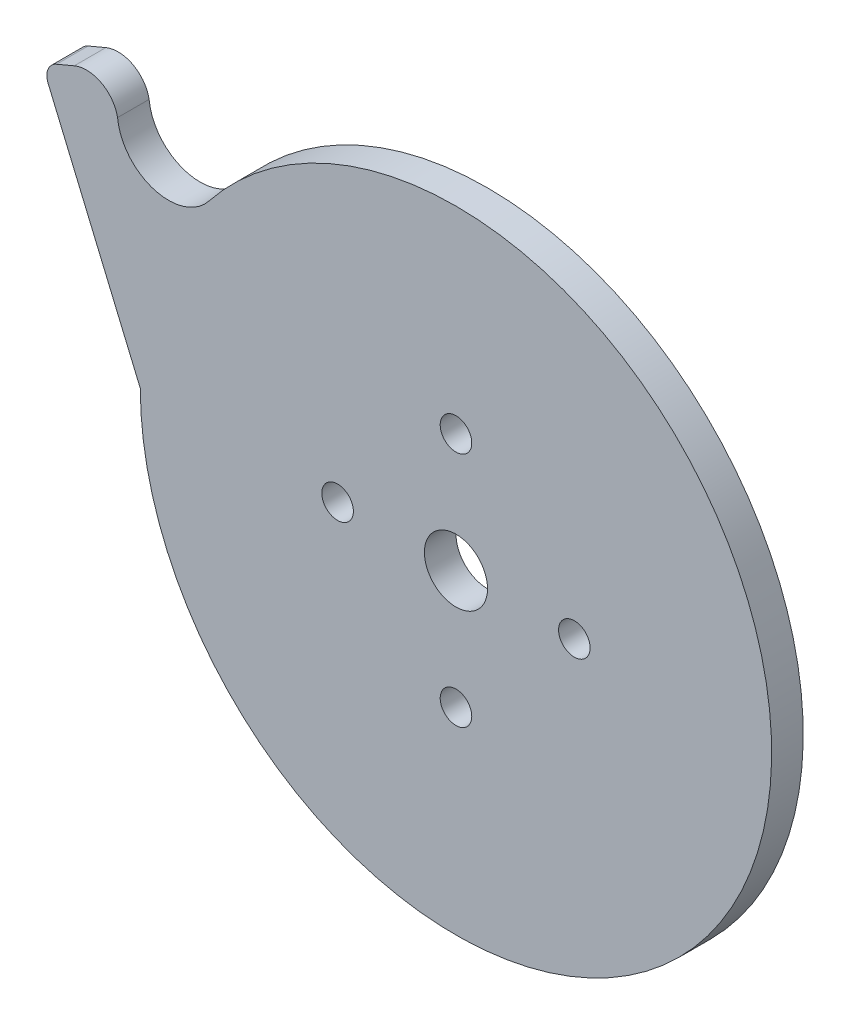
from build123d import *

# Parameters (mm, degrees)
SKETCH1_R           = 4
SKETCH1_R_2         = 2
BOSS_EXTRUDE1_DEPTH = 4


with BuildPart() as part:
    # Sketch1 → Boss-Extrude1 (new body)
    with BuildSketch(Plane.XY):
        with BuildLine():
            Line((-40, 0), (-51.681216052, 27.63239388))
            ThreePointArc((-51.681216052, 27.63239388), (-51.692317805, 29.163087351), (-50.617804197, 30.253301209))
            Line((-50.617804197, 30.253301209), (-48.367404943, 31.204626671))
            ThreePointArc((-48.367404943, 31.204626671), (-44.922000222, 31.046750266), (-42.880225189, 28.267021256))
            ThreePointArc((-42.880225189, 28.267021256), (-38.242591008, 22.682316206), (-31.323061762, 24.877013524))
            ThreePointArc((-31.323061762, 24.877013524), (37.768521751, -13.17341128), (-40, 0))
        make_face()
        Circle(SKETCH1_R, mode=Mode.SUBTRACT)
        with Locations((0, 15)):
            Circle(SKETCH1_R_2, mode=Mode.SUBTRACT)
        with Locations((15, 0)):
            Circle(SKETCH1_R_2, mode=Mode.SUBTRACT)
        with Locations((0, -15)):
            Circle(SKETCH1_R_2, mode=Mode.SUBTRACT)
        with Locations((-15, 0)):
            Circle(SKETCH1_R_2, mode=Mode.SUBTRACT)
    extrude(amount=BOSS_EXTRUDE1_DEPTH)


solid = part.part
